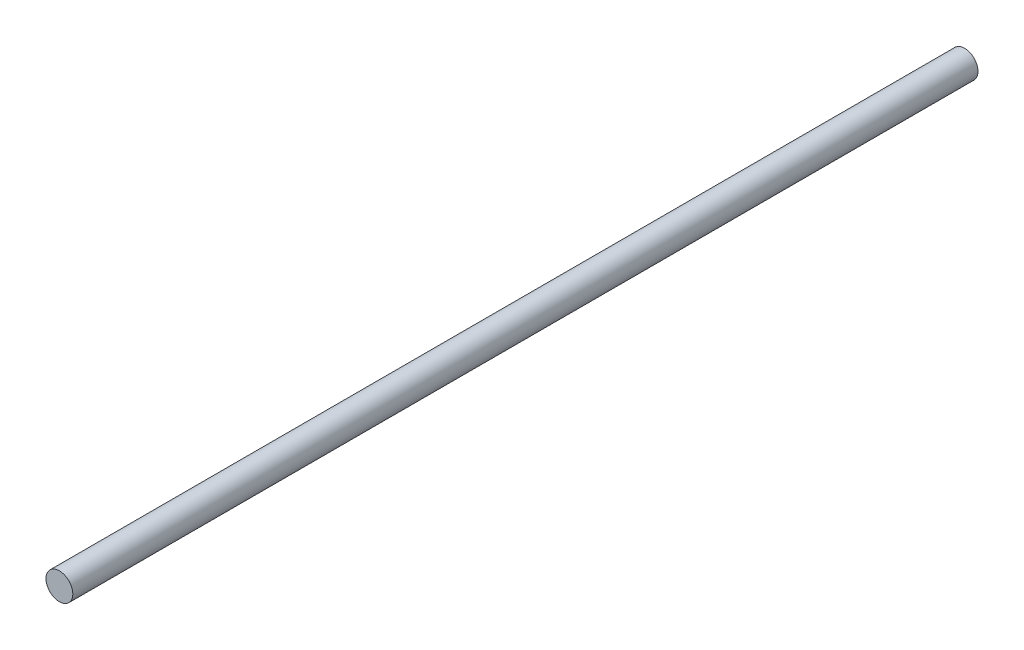
from build123d import *

# Parameters (mm, degrees)
SKETCH1_R           = 6
BOSS_EXTRUDE1_DEPTH = 405


with BuildPart() as part:
    # Sketch1 → Boss-Extrude1 (new body)
    with BuildSketch(Plane.XY):
        Circle(SKETCH1_R)
    extrude(amount=BOSS_EXTRUDE1_DEPTH)


solid = part.part
